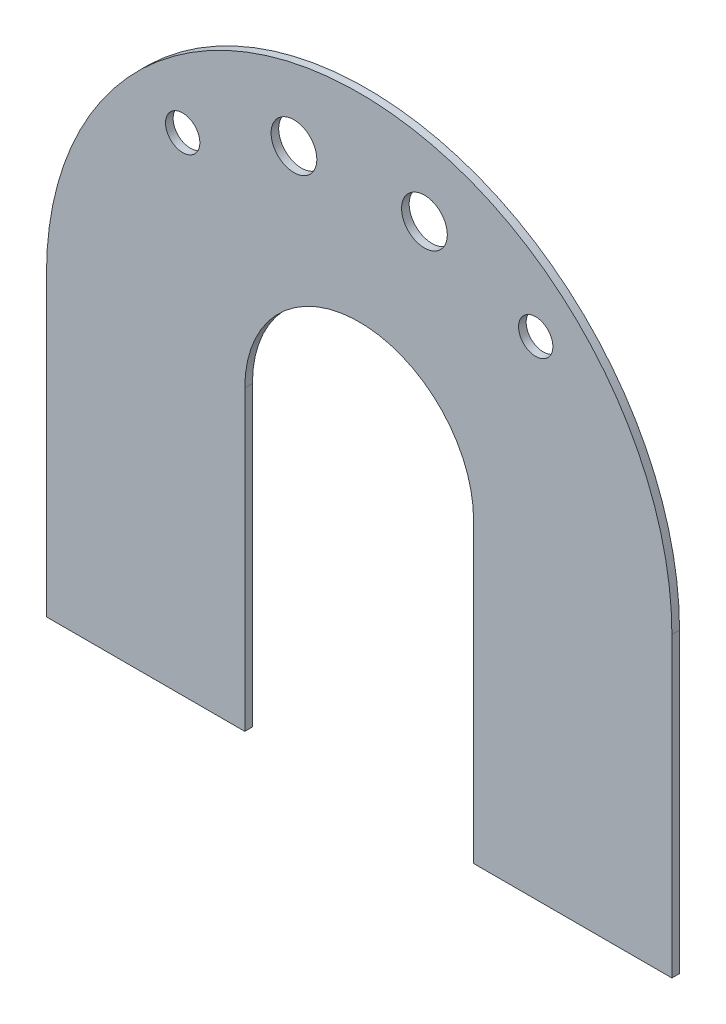
from build123d import *

# Parameters (mm, degrees)
EXTRUDE_1_DEPTH     = 10
SKETCH_3_R          = 30
SKETCH_3_R_2        = 22.5
CUT_EXTRUDE_3_DEPTH = 50


with BuildPart() as part:
    # 草图1 → 凸台-拉伸1 (new body)
    with BuildSketch(Plane.XY):
        with BuildLine():
            Line((-410, 0), (-410, -390))
            Line((-410, -390), (410, -390))
            Line((410, -390), (410, 0))
            ThreePointArc((410, 0), (0, 410), (-410, 0))
        make_face()
    extrude(amount=EXTRUDE_1_DEPTH)

    # 草图3 → 切除-拉伸3 (cut)
    with BuildSketch(Plane.XY.offset(10)):
        with Locations((-85.536299808, 306.665948586)):
            Circle(SKETCH_3_R)
        with Locations((85.536299808, 306.665948586)):
            Circle(SKETCH_3_R)
        with Locations((-231.415444704, 248.973278177)):
            Circle(SKETCH_3_R_2)
        with Locations((231.415444704, 248.973278177)):
            Circle(SKETCH_3_R_2)
        with BuildLine():
            Line((-150, 0), (-150, -390))
            Line((-150, -390), (150, -390))
            Line((150, -390), (150, 0))
            ThreePointArc((150, 0), (0, 150), (-150, 0))
        make_face()
    extrude(amount=-CUT_EXTRUDE_3_DEPTH, mode=Mode.SUBTRACT)


solid = part.part
